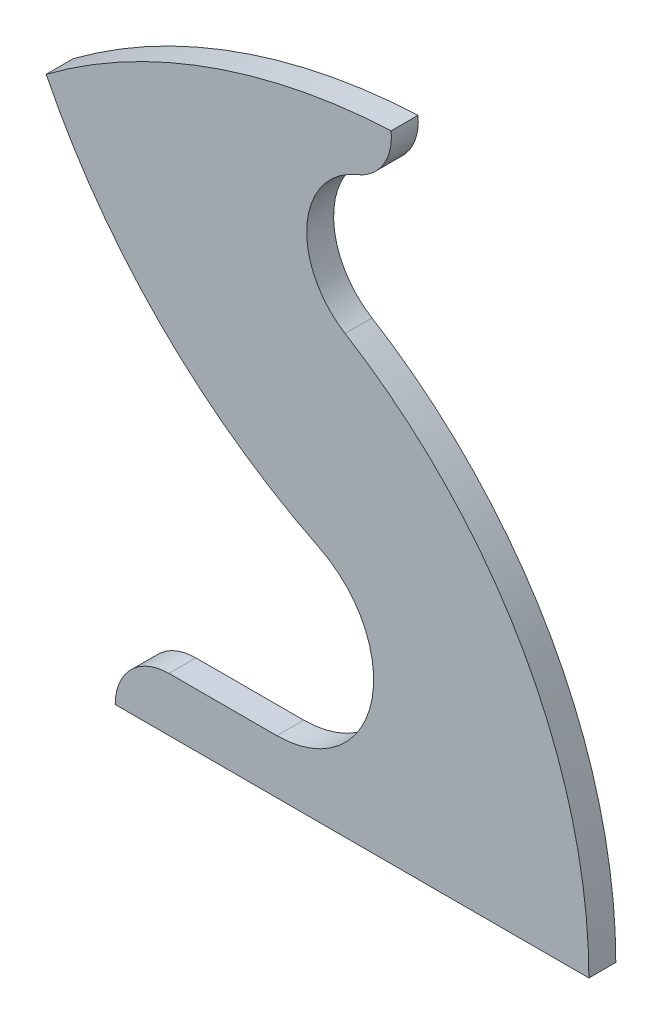
from build123d import *

# Parameters (mm, degrees)
BOSS_EXTRUDE1_DEPTH = 5


with BuildPart() as part:
    # Sketch1 → Boss-Extrude1 (new body)
    with BuildSketch(Plane.XY):
        with BuildLine():
            ThreePointArc((14.997095472, 79.753001356), (19.811312597, 83.805122165), (21.252071738, 89.930526859))
            ThreePointArc((21.252071738, 89.930526859), (-12.511912674, 83.267872862), (-42.835125453, 66.992112713))
            ThreePointArc((-42.835125453, 66.992112713), (-21.592512505, 37.387836987), (7.997709308, 16.125651795))
            ThreePointArc((7.997709308, 16.125651795), (17.525149533, -4.107205113), (0, -18))
            Line((0, -18), (-20.016448778, -18))
            ThreePointArc((-20.016448778, -18), (-27.087516589, -20.928932188), (-30.016448778, -28))
            Line((-30.016448778, -28), (57.983551222, -28))
            ThreePointArc((57.983551222, -28), (45.893125435, 18.420717493), (12.694098189, 53.045650682))
            ThreePointArc((12.694098189, 53.045650682), (5.610650395, 67.109432367), (14.997095472, 79.753001356))
        make_face()
    extrude(amount=BOSS_EXTRUDE1_DEPTH)


solid = part.part
